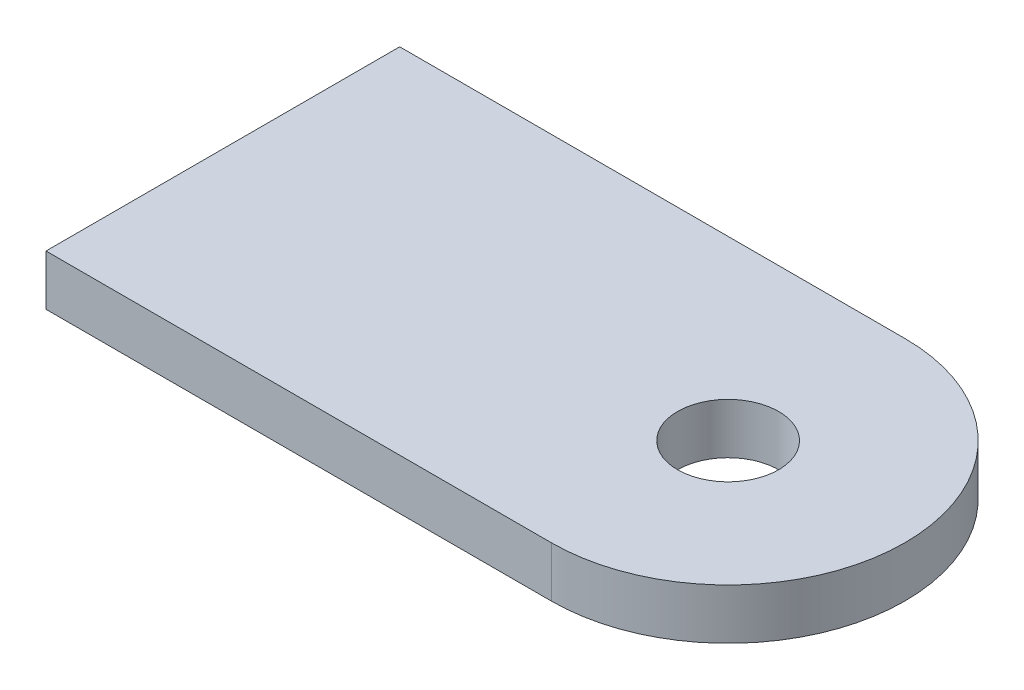
from build123d import *

# Parameters (mm, degrees)
SKETCH1_R           = 0.1
BOSS_EXTRUDE1_DEPTH = 0.1


with BuildPart() as part:
    # Sketch1 → Boss-Extrude1 (new body)
    with BuildSketch(Plane(origin=(0, 0, 0), x_dir=(1, 0, 0), z_dir=(0, 1, 0))):
        with BuildLine():
            Line((0, 0), (0, 0.7))
            Line((0, 0.7), (1, 0.7))
            ThreePointArc((1, 0.7), (1.35, 0.35), (1, 0))
            Line((1, 0), (0, 0))
        make_face()
        with Locations(Location((1, 0.35, 0), (0, 0, 270))):
            Circle(SKETCH1_R, mode=Mode.SUBTRACT)
    extrude(amount=BOSS_EXTRUDE1_DEPTH)


solid = part.part
